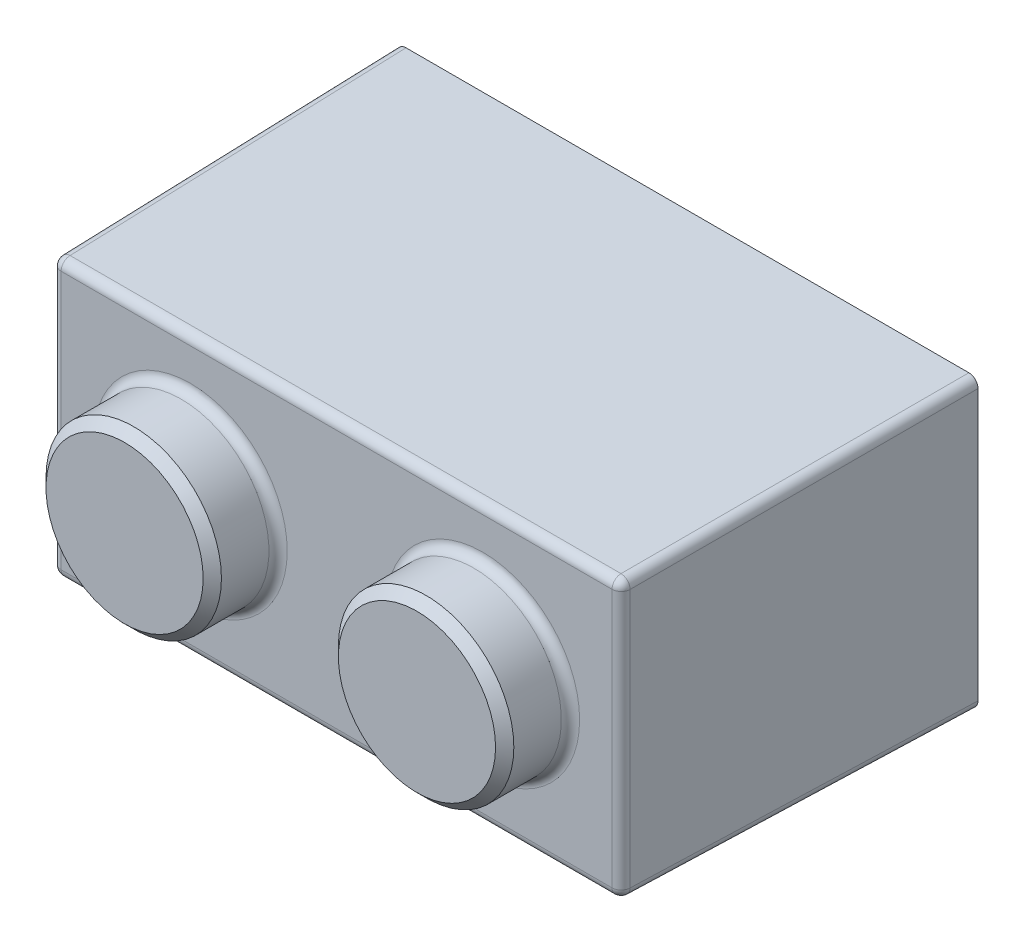
from build123d import *

# Parameters (mm, degrees)
SKETCH1_W            = 15.9
SKETCH1_H            = 7.9
MAIN_BODY_DEPTH      = 9.6
MAIN_BODY_TAPER      = 1
SKETCH2_R            = 2.4
POST_DEPTH           = 1.8
POST_LPATTERN1_COUNT = 2
POST_LPATTERN1_PITCH = 8
SHELL1_T             = -1.2
BODY_FILLET_R        = 0.25
POST_CHAMFER_SIZE    = 0.25


with BuildPart() as part:
    # Sketch1 → Main Body (new body)
    with BuildSketch(Plane.XY):
        with Locations((7.95, 3.95)):
            Rectangle(SKETCH1_W, SKETCH1_H)
    extrude(amount=MAIN_BODY_DEPTH, taper=MAIN_BODY_TAPER)

    # Sketch2 → Post (add)
    with BuildSketch(Plane.XY.offset(9.6)):
        with Locations(Location((3.95, 3.95, 0), (0, 0, 180))):
            Circle(SKETCH2_R)
    post = extrude(amount=POST_DEPTH)

    # Post LPattern1: Post ×2
    with Locations(*[(i * POST_LPATTERN1_PITCH, 0, 0) for i in range(1, POST_LPATTERN1_COUNT)]):
        add(post)

    # Shell1
    shell1_openings = [part.faces().sort_by_distance(p)[0] for p in [
        (7.95, 3.95, 0),
    ]]
    offset(amount=SHELL1_T, openings=shell1_openings, kind=Kind.INTERSECTION)

    # Body Fillet
    body_fillet_edges = [part.edges().sort_by_distance(p)[0] for p in [
        (15.732431377, 3.95, 9.6),
        (6.35, 3.95, 9.6),
        (7.95, 7.732431377, 9.6),
        (14.35, 3.95, 9.6),
        (0.167568623, 3.95, 9.6),
        (0.083784312, 7.816215688, 4.8),
        (15.816215688, 7.816215688, 4.8),
        (15.816215688, 0.083784312, 4.8),
        (0.083784312, 0.083784312, 4.8),
        (7.95, 0.167568623, 9.6),
    ]]
    fillet(body_fillet_edges, radius=BODY_FILLET_R)

    # Post Chamfer
    post_chamfer_edges = [part.edges().sort_by_distance(p)[0] for p in [
        (6.35, 3.95, 11.4),
        (14.35, 3.95, 11.4),
    ]]
    chamfer(post_chamfer_edges, length=POST_CHAMFER_SIZE)


solid = part.part
